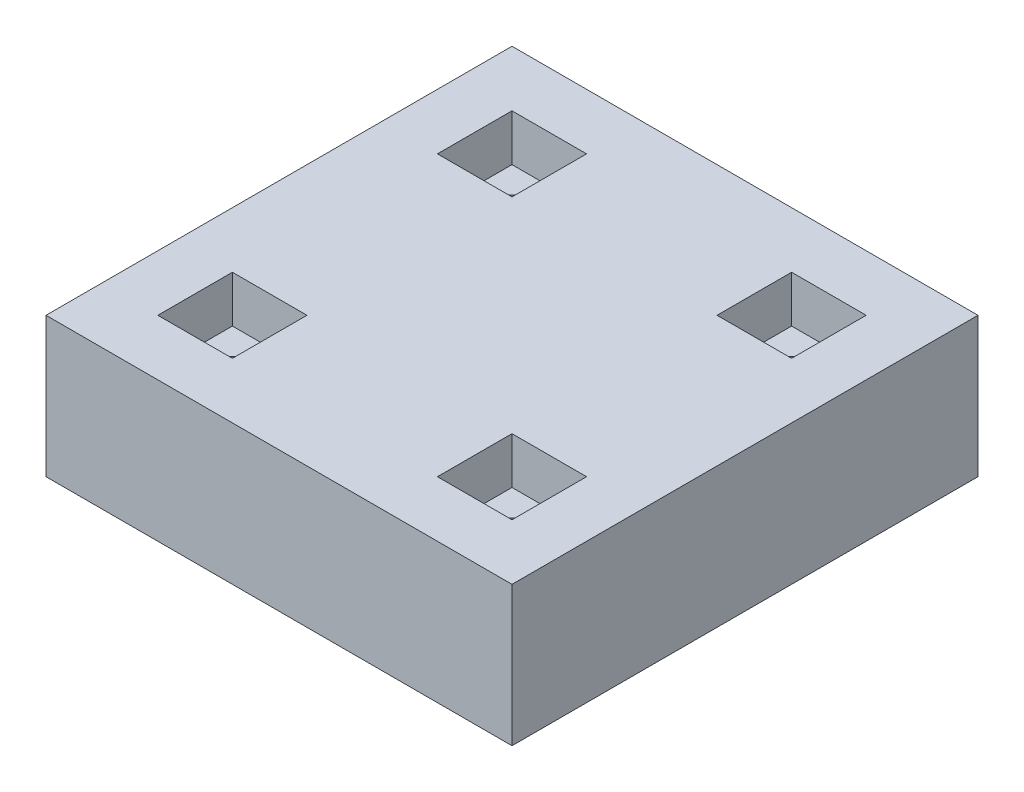
from build123d import *

# Parameters (mm, degrees)
SKETCH1_W                             = 50
SKETCH1_H                             = 50
BOSS_EXTRUDE1_DEPTH                   = 15
TAP_DRILL_FOR_M4X0_7_TAP1_D           = 3.3
TAP_DRILL_FOR_M4X0_7_TAP1_CSINK_D     = 3.35
TAP_DRILL_FOR_M4X0_7_TAP1_CSINK_ANGLE = 90
SKETCH3_W                             = 8
SKETCH3_H                             = 8
CUT_EXTRUDE2_DEPTH                    = 5


with BuildPart() as part:
    # Sketch1 → Boss-Extrude1 (new body)
    with BuildSketch(Plane(origin=(0, 0, 0), x_dir=(1, 0, 0), z_dir=(0, 1, 0))):
        Rectangle(SKETCH1_W, SKETCH1_H)
    extrude(amount=BOSS_EXTRUDE1_DEPTH)

    # Tap Drill for M4x0.7 Tap1 (through all)
    with Locations(Plane(origin=(0, 15, 0), x_dir=(1, 0, 0), z_dir=(0, 1, 0))):
        with Locations((-15, 15), (15, 15), (15, -15), (-15, -15)):
            CounterSinkHole(TAP_DRILL_FOR_M4X0_7_TAP1_D / 2, TAP_DRILL_FOR_M4X0_7_TAP1_CSINK_D / 2, counter_sink_angle=TAP_DRILL_FOR_M4X0_7_TAP1_CSINK_ANGLE)

    # Sketch3 → Cut-Extrude2 (cut)
    with BuildSketch(Plane(origin=(0, 15, 0), x_dir=(1, 0, 0), z_dir=(0, 1, 0))):
        with Locations((15, 15)):
            Rectangle(SKETCH3_W, SKETCH3_H)
        with Locations((-15, 15)):
            Rectangle(SKETCH3_W, SKETCH3_H)
        with Locations((-15, -15)):
            Rectangle(SKETCH3_W, SKETCH3_H)
        with Locations((15, -15)):
            Rectangle(SKETCH3_W, SKETCH3_H)
    extrude(amount=-CUT_EXTRUDE2_DEPTH, mode=Mode.SUBTRACT)


solid = part.part
